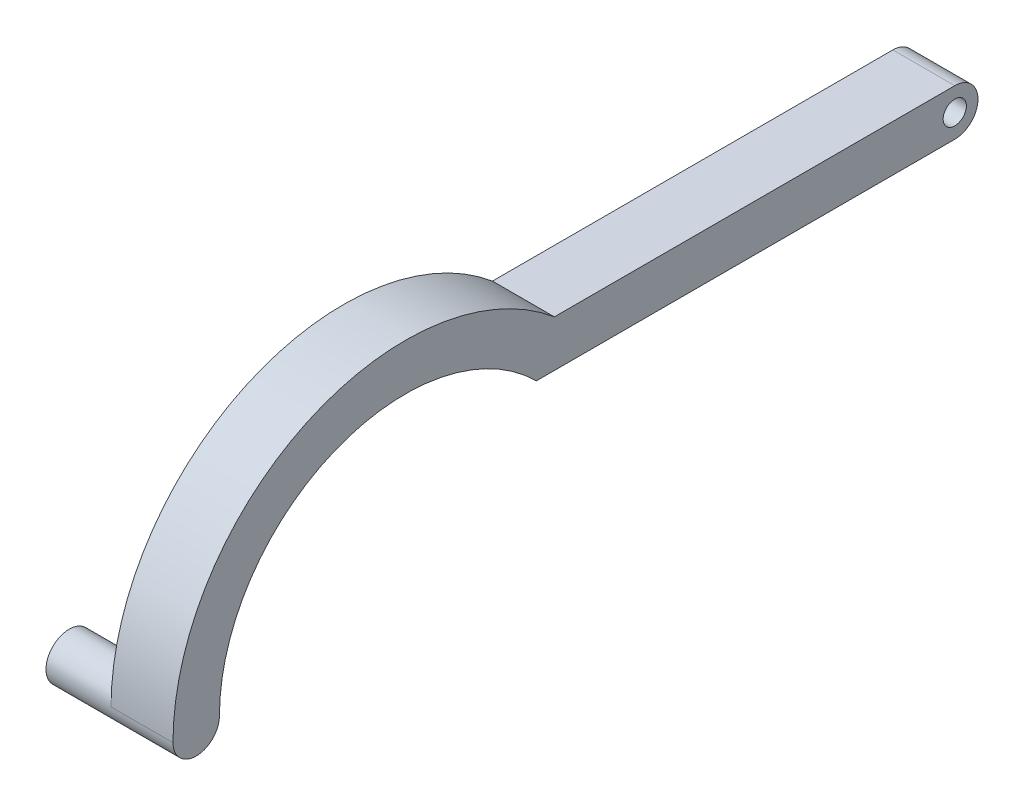
from build123d import *

# Parameters (mm, degrees)
SKETCH1_R           = 0.75
BOSS_EXTRUDE1_DEPTH = 4
BOSS_EXTRUDE2_START = 4.2
SKETCH2_R           = 1.5
BOSS_EXTRUDE2_DEPTH = 4.2


with BuildPart() as part:
    # Sketch1 → Boss-Extrude1 (new body)
    with BuildSketch(Plane(origin=(0, 0, 0), x_dir=(0, 0, -1), z_dir=(1, 0, 0))):
        with BuildLine():
            Line((48.989794856, 11.5), (23.130680142, 11.5))
            ThreePointArc((23.130680142, 11.5), (7.154143168, 13.591545205), (-1.5, 0))
            ThreePointArc((-1.5, 0), (0, -1.5), (1.5, 0))
            ThreePointArc((1.5, 0), (8.898176779, 11.08256392), (21.970537173, 8.5))
            Line((21.970537173, 8.5), (48.989794856, 8.5))
            ThreePointArc((48.989794856, 8.5), (50.489794856, 10), (48.989794856, 11.5))
        make_face()
        with Locations((48.989794856, 10)):
            Circle(SKETCH1_R, mode=Mode.SUBTRACT)
    extrude(amount=BOSS_EXTRUDE1_DEPTH)

    # Sketch2 → Boss-Extrude2 (add)
    with BuildSketch(Plane.ZY.offset(BOSS_EXTRUDE2_START)):
        Circle(SKETCH2_R)
    extrude(amount=-BOSS_EXTRUDE2_DEPTH)


solid = part.part
